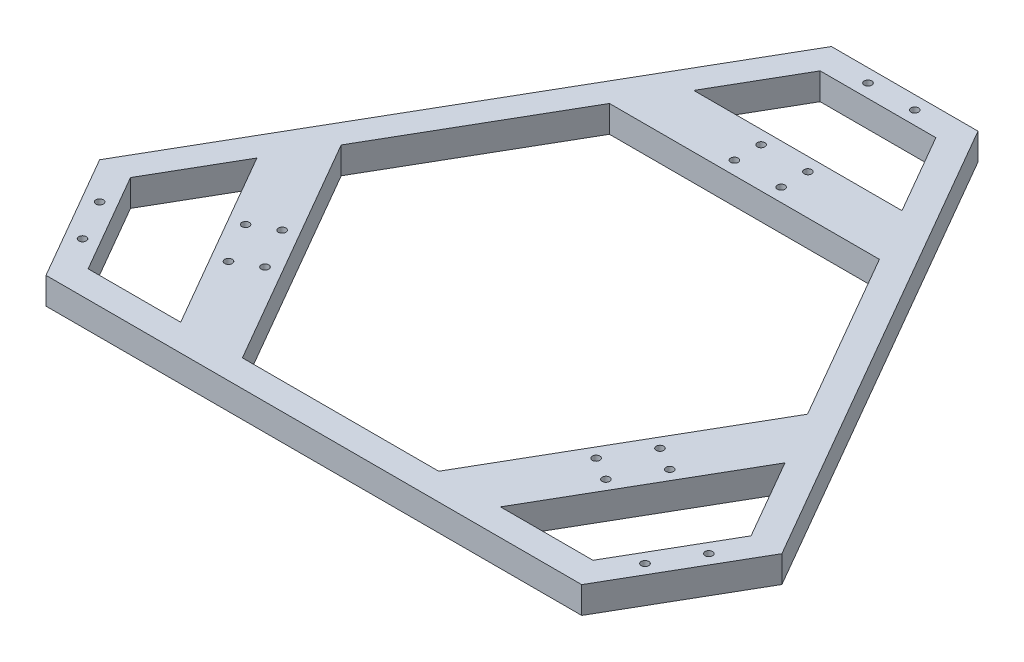
from build123d import *

# Parameters (mm, degrees)
BOSS_EXTRUDE2_DEPTH = 25.4
SKETCH2_R           = 3.571875
CUT_EXTRUDE1_DEPTH  = 25.4


with BuildPart() as part:
    # Sketch1 → Boss-Extrude2 (new body)
    # profile 1 of 4: a face of its own
    with BuildSketch(Plane(origin=(0, 0, 0), x_dir=(1, 0, 0), z_dir=(0, 1, 0))):
        Polygon((-69.664713837, 334.281849575), (-324.328930675, -106.809512857), (-254.664216837, -227.472336718), (254.664216837, -227.472336718), (324.328930675, -106.809512857), (69.664713837, 334.281849575), align=None)
        Polygon((-239.99952, -202.072336718), (-294.999537, -106.809512857), (-55.000017, 308.881849575), (55.000017, 308.881849575), (294.999537, -106.809512857), (239.99952, -202.072336718), align=None, mode=Mode.SUBTRACT)
    # profile 2 of 4: a face of its own
    with BuildSketch(Plane(origin=(0, 0, 0), x_dir=(1, 0, 0), z_dir=(0, 1, 0))):
        Polygon((-93.352551626, -202.072336718), (-221.676052813, 20.190487143), (-251.005446488, -30.609512857), (-152.011338976, -202.072336718), align=None)
    # profile 3 of 4: a face of its own
    with BuildSketch(Plane(origin=(0, 0, 0), x_dir=(1, 0, 0), z_dir=(0, 1, 0))):
        Polygon((251.005446488, -30.609512857), (221.676052813, 20.190487143), (93.352551626, -202.072336718), (152.011338976, -202.072336718), align=None)
    # profile 4 of 4: a face of its own
    with BuildSketch(Plane(origin=(0, 0, 0), x_dir=(1, 0, 0), z_dir=(0, 1, 0))):
        Polygon((98.994107512, 232.681849575), (-98.994107512, 232.681849575), (-128.323501187, 181.881849575), (128.323501187, 181.881849575), align=None)
    extrude(amount=BOSS_EXTRUDE2_DEPTH)

    # Sketch2 → Cut-Extrude1 (cut)
    with BuildSketch(Plane.XZ):
        with Locations(Location((-289.610551128, 141.543510188, 0), (0, 0, 270))):
            Circle(SKETCH2_R)
        with Locations(Location((-267.385551128, 180.038339387, 0), (0, 0, 270))):
            Circle(SKETCH2_R)
        with Locations(Location((267.385551128, 180.038339387, 0), (0, 0, 270))):
            Circle(SKETCH2_R)
        with Locations(Location((289.610551128, 141.543510188, 0), (0, 0, 270))):
            Circle(SKETCH2_R)
        with Locations(Location((22.225, -321.581849575, 0), (0, 0, 270))):
            Circle(SKETCH2_R)
        with Locations(Location((-22.225, -321.581849575, 0), (0, 0, 270))):
            Circle(SKETCH2_R)
        with Locations(Location((-201.622370104, 90.743510188, 0), (0, 0, 270))):
            Circle(SKETCH2_R)
        with Locations(Location((-179.397370104, 129.238339387, 0), (0, 0, 270))):
            Circle(SKETCH2_R)
        with Locations(Location((-157.400324847, 116.538339387, 0), (0, 0, 270))):
            Circle(SKETCH2_R)
        with Locations(Location((-179.625324847, 78.043510188, 0), (0, 0, 270))):
            Circle(SKETCH2_R)
        with Locations(Location((201.622370104, 90.743510188, 0), (0, 0, 270))):
            Circle(SKETCH2_R)
        with Locations(Location((179.397370104, 129.238339387, 0), (0, 0, 270))):
            Circle(SKETCH2_R)
        with Locations(Location((-22.225, -219.981849575, 0), (0, 0, 270))):
            Circle(SKETCH2_R)
        with Locations(Location((22.225, -219.981849575, 0), (0, 0, 270))):
            Circle(SKETCH2_R)
        with Locations(Location((179.625324847, 78.043510188, 0), (0, 0, 270))):
            Circle(SKETCH2_R)
        with Locations(Location((157.400324847, 116.538339387, 0), (0, 0, 270))):
            Circle(SKETCH2_R)
        with Locations(Location((-22.225, -194.581849575, 0), (0, 0, 270))):
            Circle(SKETCH2_R)
        with Locations(Location((22.225, -194.581849575, 0), (0, 0, 270))):
            Circle(SKETCH2_R)
    extrude(amount=-CUT_EXTRUDE1_DEPTH, mode=Mode.SUBTRACT)


solid = part.part
